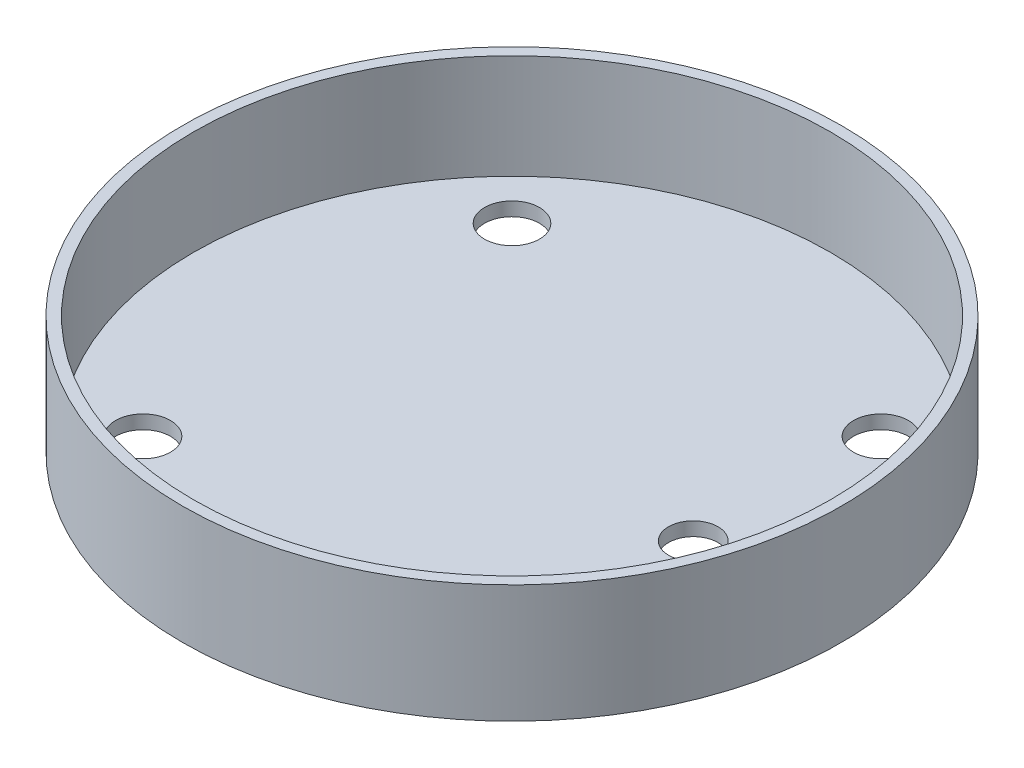
from build123d import *

# Parameters (mm, degrees)
SKETCH1_R           = 60
BOSS_EXTRUDE1_DEPTH = 2.5
SKETCH2_R           = 60
SKETCH2_R_2         = 58
BOSS_EXTRUDE2_DEPTH = 19
SKETCH3_R           = 4.5
SKETCH3_R_2         = 5
CUT_EXTRUDE1_DEPTH  = 87.954010833


with BuildPart() as part:
    # Sketch1 → Boss-Extrude1 (new body)
    with BuildSketch(Plane(origin=(0, 0, 0), x_dir=(1, 0, 0), z_dir=(0, 1, 0))):
        with Locations(Location((0, 0, 0), (0, 0, 270))):
            Circle(SKETCH1_R)
    extrude(amount=BOSS_EXTRUDE1_DEPTH)

    # Sketch2 → Boss-Extrude2 (add)
    with BuildSketch(Plane(origin=(0, 2.5, 0), x_dir=(1, 0, 0), z_dir=(0, 1, 0))):
        with Locations(Location((0, 0, 0), (0, 0, 270))):
            Circle(SKETCH2_R)
        with Locations(Location((0, 0, 0), (0, 0, 270))):
            Circle(SKETCH2_R_2, mode=Mode.SUBTRACT)
    extrude(amount=BOSS_EXTRUDE2_DEPTH)

    # Sketch3 → Cut-Extrude1 (cut, through all)
    with BuildSketch(Plane(origin=(0, 2.5, 0), x_dir=(1, 0, 0), z_dir=(0, 1, 0))):
        with Locations(Location((33, 0, 0), (0, 0, 270))):
            Circle(SKETCH3_R)
        with Locations(Location((33.587572106, 33.587572106, 0), (0, 0, 270))):
            Circle(SKETCH3_R_2)
        with Locations(Location((33.587572106, -33.587572106, 0), (0, 0, 270))):
            Circle(SKETCH3_R_2)
        with Locations(Location((-33.587572106, -33.587572106, 0), (0, 0, 270))):
            Circle(SKETCH3_R_2)
        with Locations(Location((-33.587572106, 33.587572106, 0), (0, 0, 270))):
            Circle(SKETCH3_R_2)
    extrude(amount=-CUT_EXTRUDE1_DEPTH, mode=Mode.SUBTRACT)


solid = part.part
